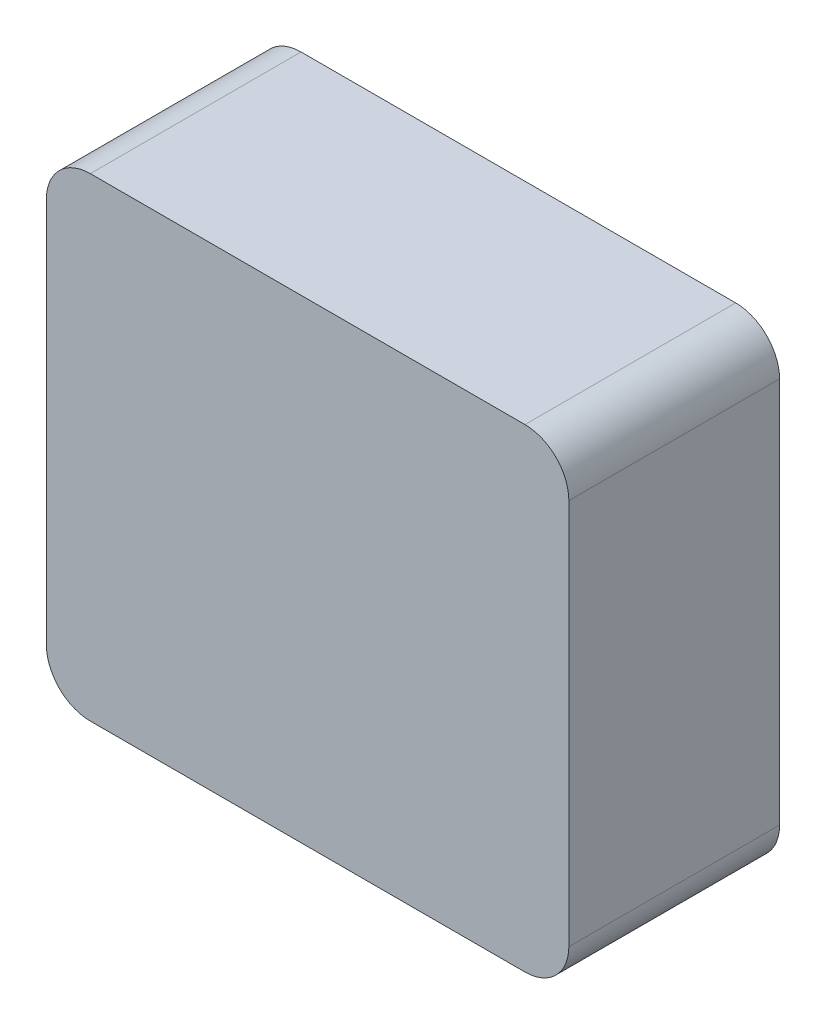
from build123d import *

# Parameters (mm, degrees)
SKETCH_1_W      = 238
SKETCH_1_H      = 216
EXTRUDE_1_DEPTH = 96
FILLET_1_R      = 20


with BuildPart() as part:
    # 草图1 → 凸台-拉伸1 (new body)
    with BuildSketch(Plane.XY):
        with Locations((-119, -108)):
            Rectangle(SKETCH_1_W, SKETCH_1_H)
    extrude(amount=EXTRUDE_1_DEPTH)

    # 圆角1
    fillet_1_edges = [part.edges().sort_by_distance(p)[0] for p in [
        (0, -216, 48),
        (-238, -216, 48),
        (-238, 0, 48),
        (0, 0, 48),
    ]]
    fillet(fillet_1_edges, radius=FILLET_1_R)


solid = part.part
